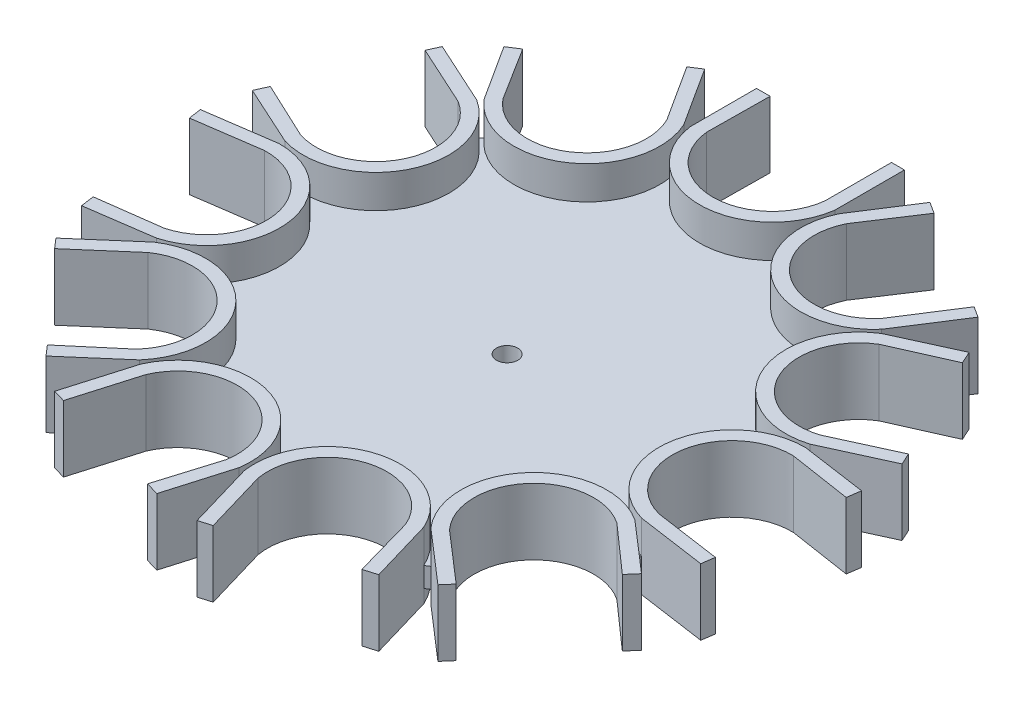
from build123d import *

# Parameters (mm, degrees)
BOSS_EXTRUDE4_DEPTH      = 3
SKETCH4_R                = 1.6
CUT_EXTRUDE1_DEPTH       = 3
BOSS_EXTRUDE6_DEPTH      = 5
BOSS_EXTRUDE6_DEPTH_BACK = 5
CUT_EXTRUDE2_START       = -10
SKETCH9_R                = 46.887146712
SKETCH9_R_2              = 40
CUT_EXTRUDE2_DEPTH       = 10
BOSS_EXTRUDE7_START      = -10
BOSS_EXTRUDE7_DEPTH      = 10


with BuildPart() as part:
    # Sketch2 → Boss-Extrude4 (new body)
    with BuildSketch(Plane(origin=(0, 0, 0), x_dir=(1, 0, 0), z_dir=(0, 1, 0))):
        with BuildLine():
            ThreePointArc((0, 31), (-6.363961031, 33.636038969), (-9, 40))
            Line((-9, 40), (-9, 45))
            ThreePointArc((-9, 45), (-12.929038245, 44.032260561), (-16.75755499, 42.722176335))
            Line((-16.75755499, 42.722176335), (-14.054350903, 38.51590867))
            ThreePointArc((-14.054350903, 38.51590867), (-16.759865341, 26.078859518), (-29.196914494, 28.784373956))
            Line((-29.196914494, 28.784373956), (-31.900118581, 32.99064162))
            ThreePointArc((-31.900118581, 32.99064162), (-34.682236443, 30.05232895), (-37.194704674, 26.880363543))
            Line((-37.194704674, 26.880363543), (-32.646544697, 24.803288478))
            ThreePointArc((-32.646544697, 24.803288478), (-28.198591856, 12.877865403), (-40.124014931, 8.429912562))
            Line((-40.124014931, 8.429912562), (-44.672174908, 10.506987627))
            ThreePointArc((-44.672174908, 10.506987627), (-45.424069624, 6.530995237), (-45.822798429, 2.504225255))
            Line((-45.822798429, 2.504225255), (-40.87369122, 3.215799446))
            ThreePointArc((-40.87369122, 3.215799446), (-30.684464698, -4.411759986), (-38.312024131, -14.600986508))
            Line((-38.312024131, -14.600986508), (-43.26113134, -15.312560699))
            ThreePointArc((-43.26113134, -15.312560699), (-41.744081651, -19.063883318), (-39.902477451, -22.666986858))
            Line((-39.902477451, -22.666986858), (-36.12372958, -19.392683189))
            ThreePointArc((-36.12372958, -19.392683189), (-23.428236805, -20.300682752), (-24.336236369, -32.996175527))
            Line((-24.336236369, -32.996175527), (-28.11498424, -36.270479197))
            ThreePointArc((-28.11498424, -36.270479197), (-24.810642702, -38.606113618), (-21.31340182, -40.641590801))
            Line((-21.31340182, -40.641590801), (-19.904739036, -35.844125933))
            ThreePointArc((-19.904739036, -35.844125933), (-8.733709262, -29.744282182), (-2.633865511, -40.915311956))
            Line((-2.633865511, -40.915311956), (-4.042528295, -45.712776824))
            ThreePointArc((-4.042528295, -45.712776824), (0, -45.891175622), (4.042528295, -45.712776824))
            Line((4.042528295, -45.712776824), (2.633865511, -40.915311956))
            ThreePointArc((2.633865511, -40.915311956), (8.733709262, -29.744282182), (19.904739036, -35.844125933))
            Line((19.904739036, -35.844125933), (21.31340182, -40.641590801))
            ThreePointArc((21.31340182, -40.641590801), (24.810642702, -38.606113618), (28.11498424, -36.270479197))
            Line((28.11498424, -36.270479197), (24.336236369, -32.996175527))
            ThreePointArc((24.336236369, -32.996175527), (23.428236805, -20.300682752), (36.12372958, -19.392683189))
            Line((36.12372958, -19.392683189), (39.902477451, -22.666986858))
            ThreePointArc((39.902477451, -22.666986858), (41.744081651, -19.063883318), (43.26113134, -15.312560699))
            Line((43.26113134, -15.312560699), (38.312024131, -14.600986508))
            ThreePointArc((38.312024131, -14.600986508), (30.684464698, -4.411759986), (40.87369122, 3.215799446))
            Line((40.87369122, 3.215799446), (45.822798429, 2.504225255))
            ThreePointArc((45.822798429, 2.504225255), (45.424069624, 6.530995237), (44.672174908, 10.506987627))
            Line((44.672174908, 10.506987627), (40.124014931, 8.429912562))
            ThreePointArc((40.124014931, 8.429912562), (28.198591856, 12.877865403), (32.646544697, 24.803288478))
            Line((32.646544697, 24.803288478), (37.194704674, 26.880363543))
            ThreePointArc((37.194704674, 26.880363543), (34.682236443, 30.05232895), (31.900118581, 32.99064162))
            Line((31.900118581, 32.99064162), (29.196914494, 28.784373956))
            ThreePointArc((29.196914494, 28.784373956), (16.759865341, 26.078859518), (14.054350903, 38.51590867))
            Line((14.054350903, 38.51590867), (16.75755499, 42.722176335))
            ThreePointArc((16.75755499, 42.722176335), (12.929038245, 44.032260561), (9, 45))
            Line((9, 45), (9, 40))
            ThreePointArc((9, 40), (6.363961031, 33.636038969), (0, 31))
        make_face()
    extrude(amount=BOSS_EXTRUDE4_DEPTH)

    # Sketch4 → Cut-Extrude1 (cut)
    with BuildSketch(Plane(origin=(0, 3, 0), x_dir=(1, 0, 0), z_dir=(0, 1, 0))):
        with Locations(Location((0, 0, 0), (0, 0, 270))):
            Circle(SKETCH4_R)
    extrude(amount=-CUT_EXTRUDE1_DEPTH, mode=Mode.SUBTRACT)

    # Sketch8 → Boss-Extrude6 (add, two sides: drawn at the far end of the back side and taken through both)
    with BuildSketch(Plane(origin=(0, 3, 0), x_dir=(1, 0, 0), z_dir=(0, 1, 0)).offset(-BOSS_EXTRUDE6_DEPTH_BACK)):
        with BuildLine():
            ThreePointArc((-8.942865522, 38.9875), (0, 31), (8.942865522, 38.9875))
            ThreePointArc((8.942865522, 38.9875), (9.922342436, 38.749801555), (10.895519435, 38.4875))
            ThreePointArc((10.895519435, 38.4875), (0, 29), (-10.895519435, 38.4875))
            ThreePointArc((-10.895519435, 38.4875), (-9.922342436, 38.749801555), (-8.942865522, 38.9875))
        make_face()
        with BuildLine():
            ThreePointArc((11.642019245, 38.268307879), (15.678583706, 24.396352452), (29.973807678, 26.487182811))
            ThreePointArc((29.973807678, 26.487182811), (29.296930018, 27.233984129), (28.601451085, 27.963493985))
            ThreePointArc((28.601451085, 27.963493985), (16.759865341, 26.078859518), (13.555016656, 37.633250238))
            ThreePointArc((13.555016656, 37.633250238), (12.602518761, 37.962830781), (11.642019245, 38.268307879))
        make_face()
        with BuildLine():
            ThreePointArc((30.483299074, 25.899198397), (26.379327865, 12.047035377), (39.535623769, 6.077372229))
            ThreePointArc((39.535623769, 6.077372229), (39.369949321, 7.071569168), (39.179278016, 8.06127621))
            ThreePointArc((39.179278016, 8.06127621), (28.198591856, 12.877865403), (31.749276822, 24.330709429))
            ThreePointArc((31.749276822, 24.330709429), (31.126169296, 25.122929466), (30.483299074, 25.899198397))
        make_face()
        with BuildLine():
            ThreePointArc((39.646346831, 5.307276419), (28.704821815, -4.12713031), (36.545158658, -16.261961095))
            ThreePointArc((36.545158658, -16.261961095), (36.943287889, -15.336019039), (37.317961005, -14.400339803))
            ThreePointArc((37.317961005, -14.400339803), (30.684464698, -4.411759986), (39.863365926, 3.303340289))
            ThreePointArc((39.863365926, 3.303340289), (39.767481007, 4.306675556), (39.646346831, 5.307276419))
        make_face()
        with BuildLine():
            ThreePointArc((36.221959597, -16.969668323), (21.916737656, -18.990961284), (21.951863889, -33.438236673))
            ThreePointArc((21.951863889, -33.438236673), (22.787393581, -32.87452956), (23.608455051, -32.289949677))
            ThreePointArc((23.608455051, -32.289949677), (23.428236805, -20.300682752), (35.32111801, -18.772816053))
            ThreePointArc((35.32111801, -18.772816053), (35.782898482, -17.876917414), (36.221959597, -16.969668323))
        make_face()
        with BuildLine():
            ThreePointArc((21.297356123, -33.858863274), (8.170244148, -27.825296235), (0.38900744, -39.99810837))
            ThreePointArc((0.38900744, -39.99810837), (1.39666282, -39.975609226), (2.403431427, -39.927728678))
            ThreePointArc((2.403431427, -39.927728678), (8.733709262, -29.744282182), (19.564664692, -34.88873594))
            ThreePointArc((19.564664692, -34.88873594), (20.437498519, -34.384715417), (21.297356123, -33.858863274))
        make_face()
        with BuildLine():
            ThreePointArc((-0.38900744, -39.99810837), (-8.170244148, -27.825296235), (-21.297356123, -33.858863274))
            ThreePointArc((-21.297356123, -33.858863274), (-20.437498519, -34.384715417), (-19.564664692, -34.88873594))
            ThreePointArc((-19.564664692, -34.88873594), (-8.733709262, -29.744282182), (-2.403431427, -39.927728678))
            ThreePointArc((-2.403431427, -39.927728678), (-1.39666282, -39.975609226), (-0.38900744, -39.99810837))
        make_face()
        with BuildLine():
            ThreePointArc((-21.951863889, -33.438236673), (-21.916737656, -18.990961284), (-36.221959597, -16.969668323))
            ThreePointArc((-36.221959597, -16.969668323), (-35.782898482, -17.876917414), (-35.32111801, -18.772816053))
            ThreePointArc((-35.32111801, -18.772816053), (-23.428236805, -20.300682752), (-23.608455051, -32.289949677))
            ThreePointArc((-23.608455051, -32.289949677), (-22.787393581, -32.87452956), (-21.951863889, -33.438236673))
        make_face()
        with BuildLine():
            ThreePointArc((-36.545158658, -16.261961095), (-28.704821815, -4.12713031), (-39.646346831, 5.307276419))
            ThreePointArc((-39.646346831, 5.307276419), (-39.767481007, 4.306675556), (-39.863365926, 3.303340289))
            ThreePointArc((-39.863365926, 3.303340289), (-30.684464698, -4.411759986), (-37.317961005, -14.400339803))
            ThreePointArc((-37.317961005, -14.400339803), (-36.943287889, -15.336019039), (-36.545158658, -16.261961095))
        make_face()
        with BuildLine():
            ThreePointArc((-39.535623769, 6.077372229), (-26.379327865, 12.047035377), (-30.483299074, 25.899198397))
            ThreePointArc((-30.483299074, 25.899198397), (-31.126169296, 25.122929466), (-31.749276822, 24.330709429))
            ThreePointArc((-31.749276822, 24.330709429), (-28.198591856, 12.877865403), (-39.179278016, 8.06127621))
            ThreePointArc((-39.179278016, 8.06127621), (-39.369949321, 7.071569168), (-39.535623769, 6.077372229))
        make_face()
        with BuildLine():
            ThreePointArc((-29.973807678, 26.487182811), (-15.678583706, 24.396352452), (-11.642019245, 38.268307879))
            ThreePointArc((-11.642019245, 38.268307879), (-12.602518761, 37.962830781), (-13.555016656, 37.633250238))
            ThreePointArc((-13.555016656, 37.633250238), (-16.759865341, 26.078859518), (-28.601451085, 27.963493985))
            ThreePointArc((-28.601451085, 27.963493985), (-29.296930018, 27.233984129), (-29.973807678, 26.487182811))
        make_face()
    extrude(amount=BOSS_EXTRUDE6_DEPTH + BOSS_EXTRUDE6_DEPTH_BACK)

    # Sketch9 → Cut-Extrude2 (cut)
    with BuildSketch(Plane(origin=(0, 3, 0), x_dir=(1, 0, 0), z_dir=(0, 1, 0)).offset(CUT_EXTRUDE2_START)):
        Circle(SKETCH9_R)
        Circle(SKETCH9_R_2, mode=Mode.SUBTRACT)
    extrude(amount=CUT_EXTRUDE2_DEPTH, mode=Mode.SUBTRACT)

    # Sketch10 → Boss-Extrude7 (add)
    with BuildSketch(Plane(origin=(0, 8, 0), x_dir=(1, 0, 0), z_dir=(0, 1, 0)).offset(BOSS_EXTRUDE7_START)):
        Polygon((-10.895519435, 38.4875), (-10.895519435, 48.4875), (-8.843923343, 48.4875), (-8.942865522, 38.9875), align=None)
        Polygon((8.942865522, 38.9875), (8.942865522, 48.9875), (10.895519435, 48.9875), (10.895519435, 38.4875), align=None)
        Polygon((18.77433988, 45.571666619), (13.555016656, 37.633250238), (11.642019245, 38.268307879), (17.04842742, 46.680843207), align=None)
        Polygon((29.973807678, 26.487182811), (28.601451085, 27.963493985), (34.007859259, 36.376029313), (35.650536262, 35.320344906), align=None)
        Polygon((40.431882844, 28.18715108), (31.749276822, 24.330709429), (30.483299074, 25.899198397), (39.579619027, 30.053348527), align=None)
        Polygon((39.535623769, 6.077372229), (39.179278016, 8.06127621), (48.27559797, 12.21542634), (49.08675972, 10.439229866), align=None)
        Polygon((49.252588683, 1.853414234), (39.863365926, 3.303340289), (39.646346831, 5.307276419), (49.544561249, 3.884128036), align=None)
        Polygon((36.545158658, -16.261961095), (37.317961005, -14.400339803), (47.216175424, -15.823488186), (46.938283798, -17.756266897), align=None)
        Polygon((42.435945618, -25.068768535), (35.32111801, -18.772816053), (36.221959597, -16.969668323), (43.77945534, -23.518275662), align=None)
        Polygon((21.951863889, -33.438236673), (23.608455051, -32.289949677), (31.165950794, -38.838557016), (29.88723442, -40.314274379), align=None)
        Polygon((22.146189656, -44.031794422), (19.564664693, -34.88873594), (21.297356123, -33.858863274), (24.114681691, -43.45379301), align=None)
        Polygon((0.38900744, -39.99810837), (2.403431427, -39.927728678), (5.220756996, -49.522658414), (3.347199287, -50.072784593), align=None)
        Polygon((-5.174825043, -49.015036694), (-2.403431427, -39.927728678), (-0.38900744, -39.99810837), (-3.206333008, -49.593038107), align=None)
        Polygon((-21.297356123, -33.858863274), (-19.564664692, -34.88873594), (-22.381990261, -44.483665676), (-24.25554797, -43.933539497), align=None)
        Polygon((-30.852869355, -38.436351139), (-23.608455051, -32.289949677), (-21.951863889, -33.438236673), (-29.509359633, -39.986844012), align=None)
        Polygon((-36.221959597, -16.969668323), (-35.32111801, -18.772816053), (-42.878613753, -25.321423392), (-44.157330127, -23.845706029), align=None)
        Polygon((-46.735345643, -15.654395676), (-37.317961005, -14.400339803), (-36.545158658, -16.261961095), (-46.443373077, -17.685109478), align=None)
        Polygon((-39.646346831, 5.307276419), (-39.863365926, 3.303340289), (-49.761580345, 1.880191906), (-50.03947197, 3.812970617), align=None)
        Polygon((-47.779679905, 12.097719806), (-39.179278016, 8.06127621), (-39.535623769, 6.077372229), (-48.631943722, 10.231522359), align=None)
        Polygon((-30.483299074, 25.899198397), (-31.749276822, 24.330709429), (-40.845596775, 28.484859559), (-40.034435025, 30.261056033), align=None)
        Polygon((-33.654303393, 36.008894728), (-28.601451085, 27.963493985), (-29.973807678, 26.487182811), (-35.380215853, 34.899718139), align=None)
        Polygon((-11.642019245, 38.268307879), (-13.555016656, 37.633250238), (-18.961424831, 46.045785566), (-17.318747829, 47.101469973), align=None)
    extrude(amount=BOSS_EXTRUDE7_DEPTH)


solid = part.part
